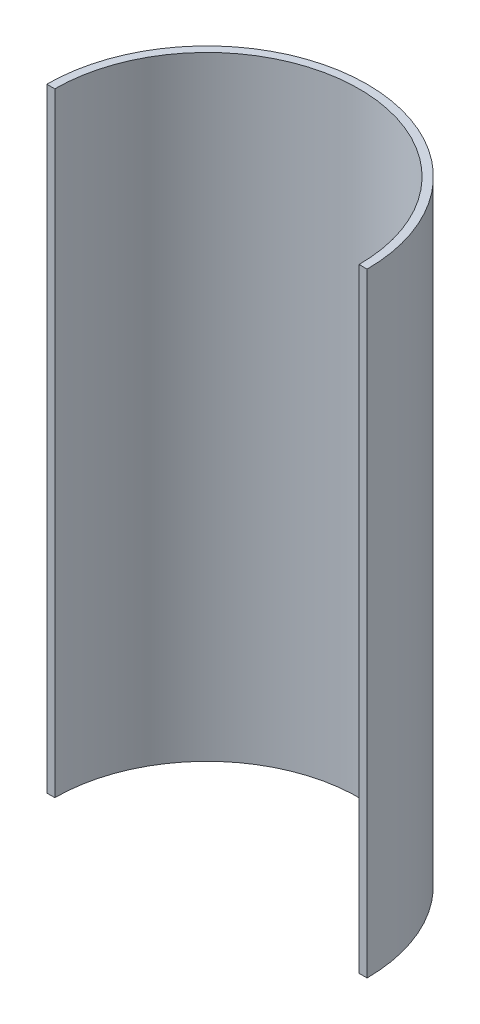
from build123d import *

# Parameters (mm, degrees)
BOSS_EXTRUDE1_DEPTH = 230


with BuildPart() as part:
    # Sketch1 → Boss-Extrude1 (new body)
    with BuildSketch(Plane(origin=(0, 0, 0), x_dir=(1, 0, 0), z_dir=(0, 1, 0))):
        with BuildLine():
            Line((-60, 0), (-57, 0))
            ThreePointArc((-57, 0), (0, 57), (57, 0))
            Line((57, 0), (60, 0))
            ThreePointArc((60, 0), (0, 60), (-60, 0))
        make_face()
    extrude(amount=BOSS_EXTRUDE1_DEPTH)


solid = part.part
